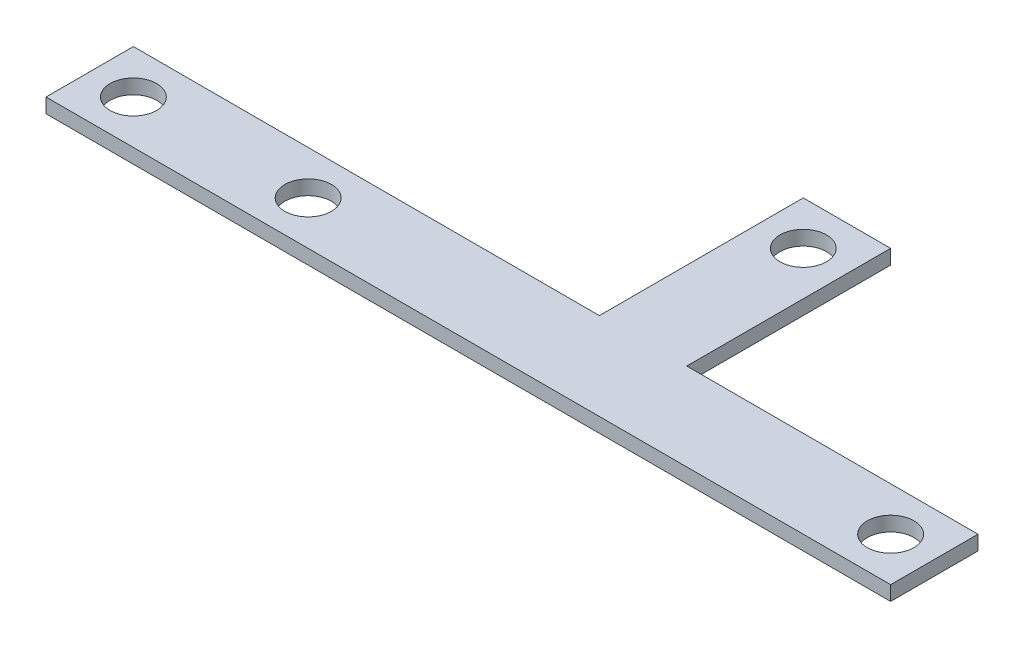
from build123d import *

# Parameters (mm, degrees)
SKETCH2_W           = 290
SKETCH2_H           = 30
SKETCH2_R           = 8
SKETCH2_W_2         = 30
SKETCH2_H_2         = 90
BOSS_EXTRUDE5_DEPTH = 5


with BuildPart() as part:
    # Sketch2 → Boss-Extrude5 (new body)
    # profile 1 of 2: a face of its own
    with BuildSketch(Plane(origin=(0, 0, 0), x_dir=(1, 0, 0), z_dir=(0, 1, 0))):
        with Locations((145, -15)):
            Rectangle(SKETCH2_W, SKETCH2_H)
        with Locations(Location((15, -15, 0), (0, 0, 270))):
            Circle(SKETCH2_R, mode=Mode.SUBTRACT)
        with Locations(Location((275, -15, 0), (0, 0, 270))):
            Circle(SKETCH2_R, mode=Mode.SUBTRACT)
        with Locations(Location((75, -15, 0), (0, 0, 270))):
            Circle(SKETCH2_R, mode=Mode.SUBTRACT)
    # profile 2 of 2: a face of its own
    with BuildSketch(Plane(origin=(0, 0, 0), x_dir=(1, 0, 0), z_dir=(0, 1, 0))):
        with Locations((175, 25)):
            Rectangle(SKETCH2_W_2, SKETCH2_H_2)
        with Locations(Location((175, 55, 0), (0, 0, 270))):
            Circle(SKETCH2_R, mode=Mode.SUBTRACT)
    extrude(amount=BOSS_EXTRUDE5_DEPTH)


solid = part.part
